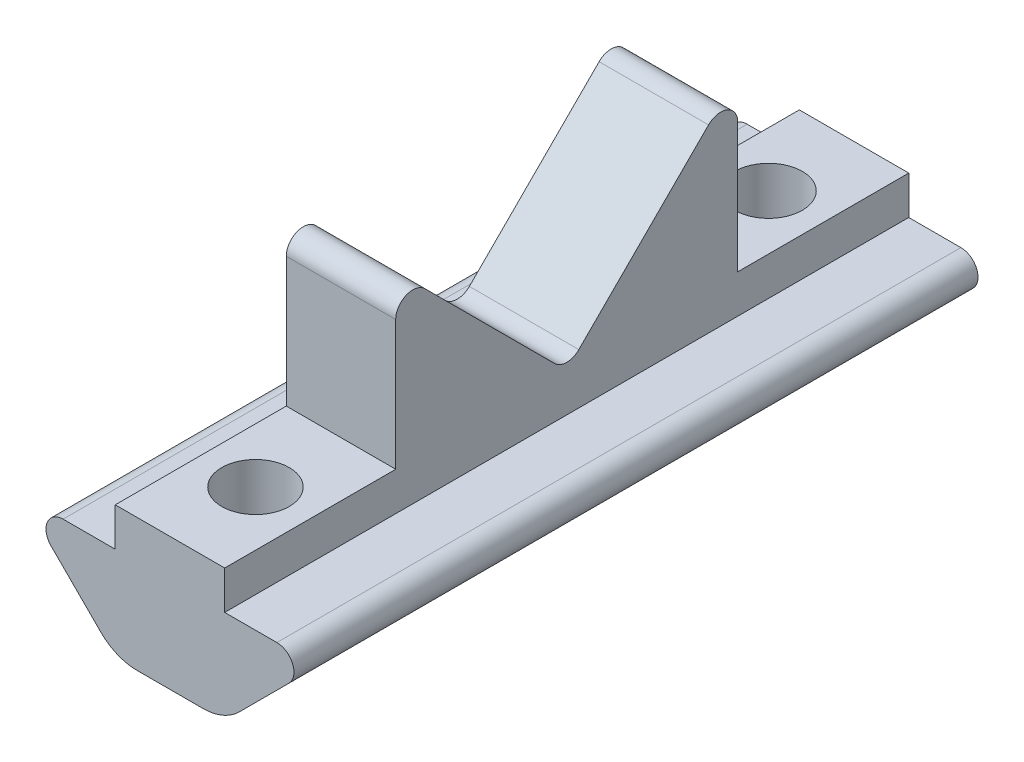
from build123d import *

# Parameters (mm, degrees)
BOSS_EXTRUDE1_DEPTH             = 20
SKETCH3_R                       = 1.975
CUT_EXTRUDE1_DEPTH              = 23.641223465
BOSS_EXTRUDE2_REACH             = 24.641
BOSS_EXTRUDE2_DIRECTION_2_REACH = 24.641
FILLET1_R                       = 1


with BuildPart() as part:
    # Sketch2 → Boss-Extrude1 (new, symmetric)
    with BuildSketch(Plane.XY):
        with BuildLine():
            Line((-1.921572875, 0), (1.921572875, 0))
            ThreePointArc((1.921572875, 0), (3.069623172, 0.228361402), (4.042893219, 0.878679656))
            Line((4.042893219, 0.878679656), (6.957106781, 3.792893219))
            ThreePointArc((6.957106781, 3.792893219), (7.173879533, 4.882683432), (6.25, 5.5))
            Line((6.25, 5.5), (3.2, 5.5))
            Line((3.2, 5.5), (3.2, 7.75))
            Line((3.2, 7.75), (-3.2, 7.75))
            Line((-3.2, 7.75), (-3.2, 5.5))
            Line((-3.2, 5.5), (-6.25, 5.5))
            ThreePointArc((-6.25, 5.5), (-7.173879533, 4.882683432), (-6.957106781, 3.792893219))
            Line((-6.957106781, 3.792893219), (-4.042893219, 0.878679656))
            ThreePointArc((-4.042893219, 0.878679656), (-3.069623172, 0.228361402), (-1.921572875, 0))
        make_face()
    extrude(amount=BOSS_EXTRUDE1_DEPTH, both=True)

    # Sketch3 → Cut-Extrude1 (cut, through all)
    with BuildSketch(Plane(origin=(0, 7.75, 0), x_dir=(1, 0, 0), z_dir=(0, 1, 0))):
        with Locations(Location((0, 15, 0), (0, 0, 270))):
            Circle(SKETCH3_R)
        with Locations(Location((0, -15, 0), (0, 0, 346.642693005))):
            Circle(SKETCH3_R)
    extrude(amount=-CUT_EXTRUDE1_DEPTH, mode=Mode.SUBTRACT)

    # Boss-Extrude2: up to this face of the body (flat: up to its plane)
    boss_extrude2_end = Plane(part.part.faces().sort_by_distance((3.2, 6.625, 0))[0])
    # Sketch4 → Boss-Extrude2 (add, up to the picked face)
    with BuildSketch(Plane(origin=(0, 0, 0), x_dir=(0, 0, -1), z_dir=(1, 0, 0)), mode=Mode.PRIVATE) as boss_extrude2_sk1:
        Polygon((-10, 17.75), (-10, 7.75), (0, 7.75), align=None)
    boss_extrude2_tool1 = split(extrude(boss_extrude2_sk1.sketch, amount=BOSS_EXTRUDE2_REACH, mode=Mode.PRIVATE), bisect_by=boss_extrude2_end, keep=Keep.BOTH, mode=Mode.PRIVATE)
    # Sketch4 → Boss-Extrude2 (add, up to the picked face)
    with BuildSketch(Plane(origin=(0, 0, 0), x_dir=(0, 0, -1), z_dir=(1, 0, 0)), mode=Mode.PRIVATE) as boss_extrude2_sk2:
        Polygon((10, 17.75), (0, 7.75), (10, 7.75), align=None)
    boss_extrude2_tool2 = split(extrude(boss_extrude2_sk2.sketch, amount=BOSS_EXTRUDE2_REACH, mode=Mode.PRIVATE), bisect_by=boss_extrude2_end, keep=Keep.BOTH, mode=Mode.PRIVATE)
    add(boss_extrude2_tool1.solids().sort_by(Axis((0, 11.083333, 6.666667), (1, 0, 0)))[0])
    add(boss_extrude2_tool2.solids().sort_by(Axis((0, 11.083333, -6.666667), (1, 0, 0)))[0])

    # Boss-Extrude2 direction 2: up to this face of the body (flat: up to its plane)
    boss_extrude2_direction_2_end = Plane(part.part.faces().sort_by_distance((-3.2, 6.625, 0))[0])
    # Sketch4 → Boss-Extrude2 direction 2 (add, up to the picked face)
    with BuildSketch(Plane(origin=(0, 0, 0), x_dir=(0, 0, -1), z_dir=(1, 0, 0)), mode=Mode.PRIVATE) as boss_extrude2_direction_2_sk1:
        Polygon((-10, 17.75), (-10, 7.75), (0, 7.75), align=None)
    boss_extrude2_direction_2_tool1 = split(extrude(boss_extrude2_direction_2_sk1.sketch, amount=-BOSS_EXTRUDE2_DIRECTION_2_REACH, mode=Mode.PRIVATE), bisect_by=boss_extrude2_direction_2_end, keep=Keep.BOTH, mode=Mode.PRIVATE)
    # Sketch4 → Boss-Extrude2 direction 2 (add, up to the picked face)
    with BuildSketch(Plane(origin=(0, 0, 0), x_dir=(0, 0, -1), z_dir=(1, 0, 0)), mode=Mode.PRIVATE) as boss_extrude2_direction_2_sk2:
        Polygon((10, 17.75), (0, 7.75), (10, 7.75), align=None)
    boss_extrude2_direction_2_tool2 = split(extrude(boss_extrude2_direction_2_sk2.sketch, amount=-BOSS_EXTRUDE2_DIRECTION_2_REACH, mode=Mode.PRIVATE), bisect_by=boss_extrude2_direction_2_end, keep=Keep.BOTH, mode=Mode.PRIVATE)
    add(boss_extrude2_direction_2_tool1.solids().sort_by(Axis((0, 11.083333, 6.666667), (-1, 0, 0)))[0])
    add(boss_extrude2_direction_2_tool2.solids().sort_by(Axis((0, 11.083333, -6.666667), (-1, 0, 0)))[0])

    # Fillet1
    fillet1_edges = [part.edges().sort_by_distance(p)[0] for p in [
        (0, 17.75, 10),
        (0, 7.75, 0),
        (0, 17.75, -10),
    ]]
    fillet(fillet1_edges, radius=FILLET1_R)


solid = part.part
